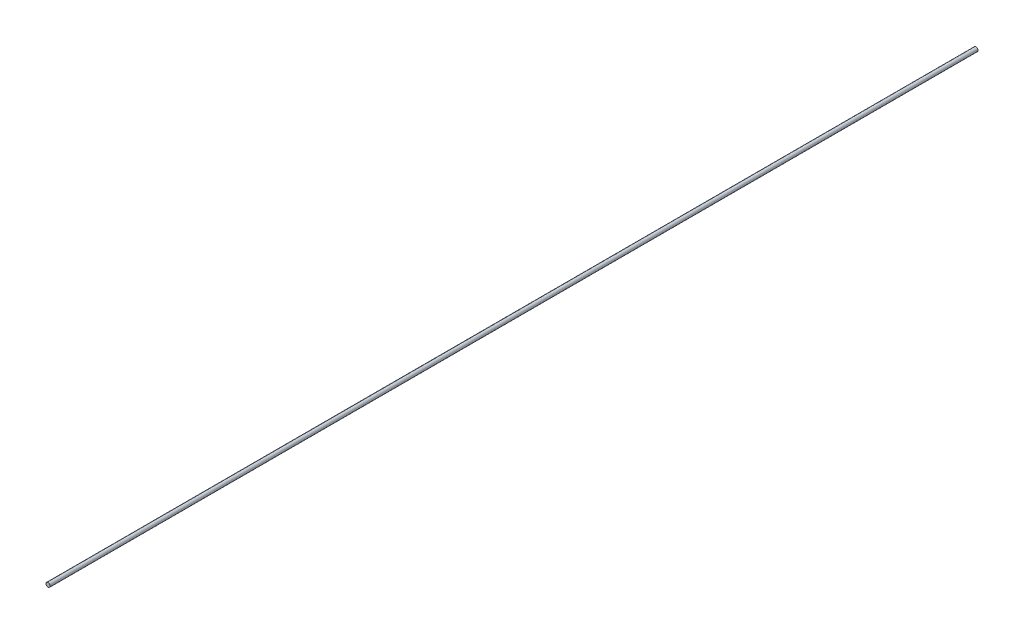
from build123d import *

# Parameters (mm, degrees)
SKETCH1_R           = 3
BOSS_EXTRUDE1_DEPTH = 1346.2


with BuildPart() as part:
    # Sketch1 → Boss-Extrude1 (new body)
    with BuildSketch(Plane.XY):
        Circle(SKETCH1_R)
    extrude(amount=BOSS_EXTRUDE1_DEPTH)


solid = part.part
